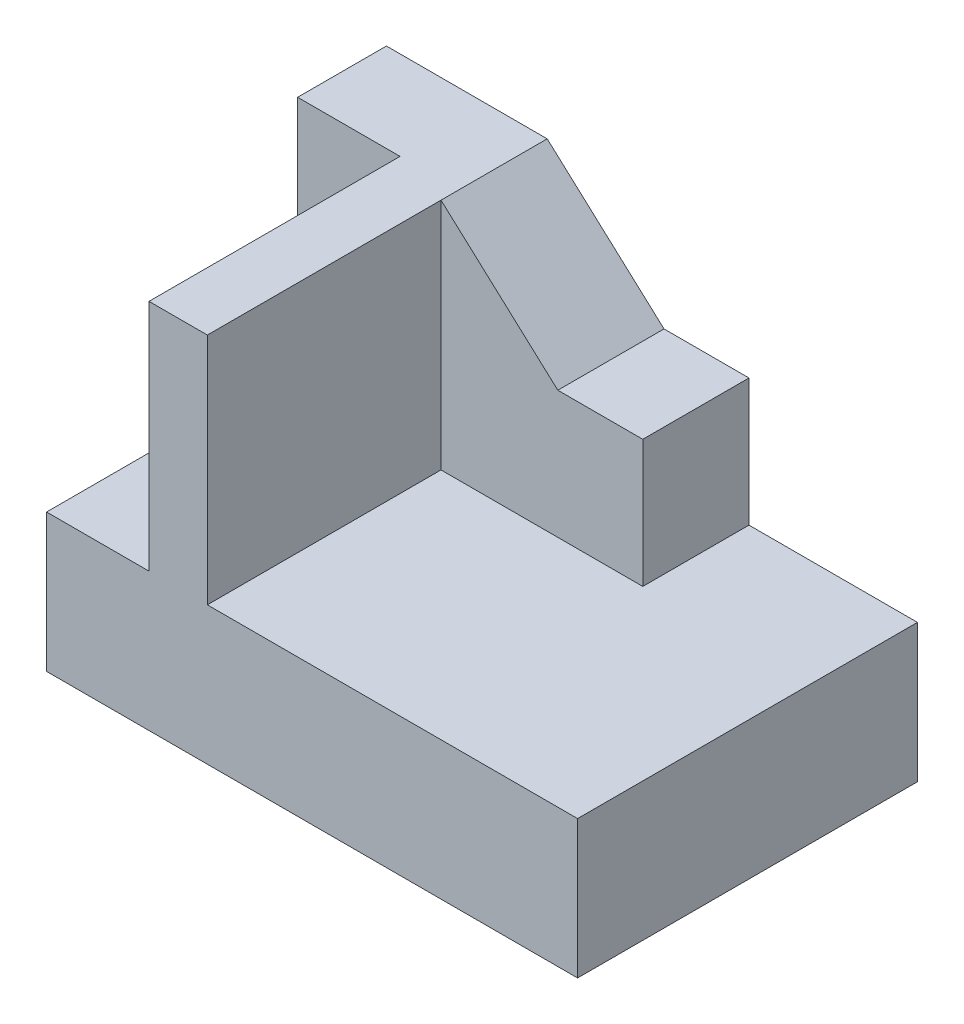
from build123d import *

# Parameters (mm, degrees)
SKETCH3_W           = 50
SKETCH3_H           = 13
BOSS_EXTRUDE1_DEPTH = 32
BOSS_EXTRUDE2_DEPTH = 32
BOSS_EXTRUDE3_DEPTH = 10
SKETCH8_W           = 9.643905297
SKETCH8_H           = 8.359669373
BOSS_EXTRUDE4_DEPTH = 22


with BuildPart() as part:
    # Sketch3 → Boss-Extrude1 (new body)
    with BuildSketch(Plane.XY):
        with Locations((7.209853726, 4.539889959)):
            Rectangle(SKETCH3_W, SKETCH3_H)
    extrude(amount=-BOSS_EXTRUDE1_DEPTH)

    # Sketch4 → Boss-Extrude2 (add)
    with BuildSketch(Plane.XY):
        Polygon((-8.146240977, 11.039889959), (-8.146240977, 33.039889959), (-2.650375504, 33.039889959), (-2.650375504, 11.039889959), (32.209853726, 11.039889959), (32.209853726, -1.960110041), (-17.790146274, -1.960110041), (-17.790146274, 11.039889959), align=None)
    extrude(amount=-BOSS_EXTRUDE2_DEPTH)

    # Sketch5 → Boss-Extrude3 (add)
    with BuildSketch(Plane(origin=(0, 0, -32), x_dir=(-1, 0, 0), z_dir=(0, 0, -1))):
        Polygon((-16.349624496, 11.039889959), (-16.349624496, 23.039889959), (-8.349624496, 23.039889959), (2.650375504, 33.039889959), (2.650375504, 11.039889959), align=None)
    extrude(amount=-BOSS_EXTRUDE3_DEPTH)

    # Sketch8 → Boss-Extrude4 (add)
    with BuildSketch(Plane(origin=(0, 11.039889959, 0), x_dir=(1, 0, 0), z_dir=(0, 1, 0))):
        with Locations((-12.968193625, 27.820165313)):
            Rectangle(SKETCH8_W, SKETCH8_H)
    extrude(amount=BOSS_EXTRUDE4_DEPTH)


solid = part.part
